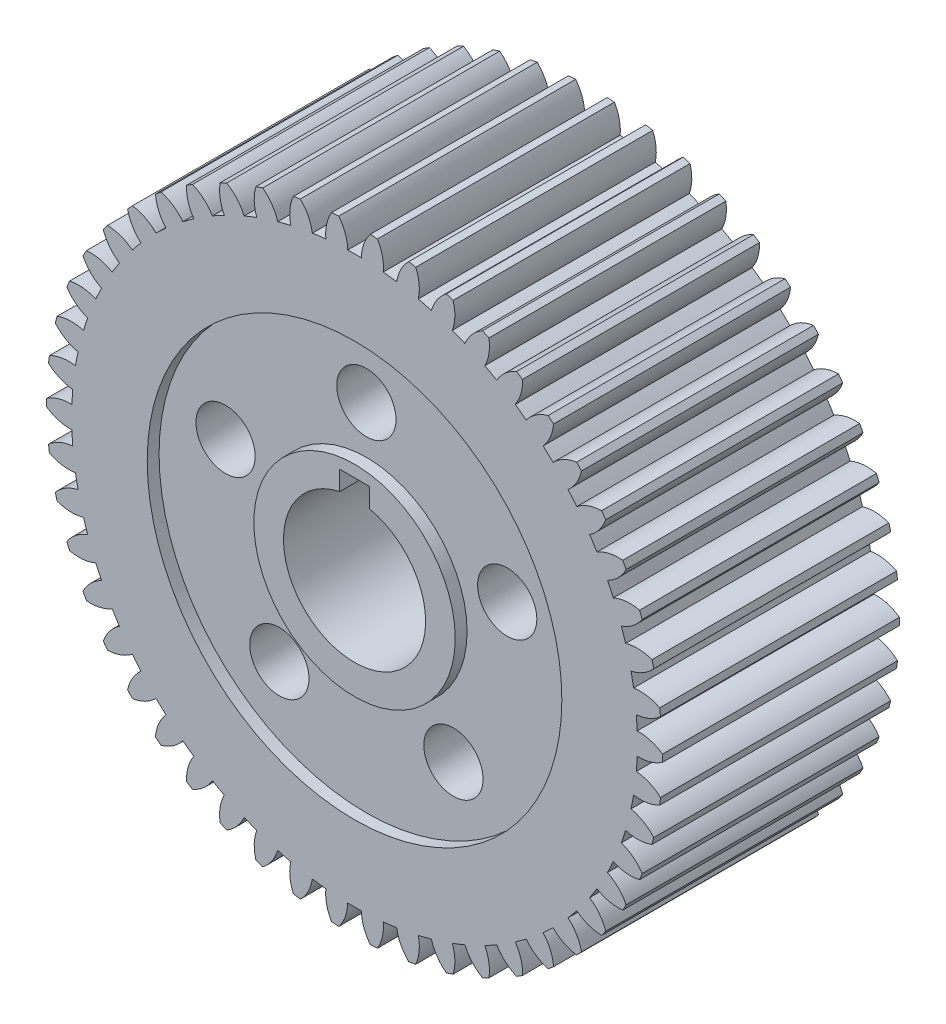
from build123d import *

# Parameters (mm, degrees)
SKETCH1_R           = 52
BOSS_EXTRUDE1_DEPTH = 20
CUT_EXTRUDE1_DEPTH  = 40
CIRPATTERN1_COUNT   = 50
CUT_EXTRUDE2_DEPTH  = 84.671466856
SKETCH5_4_R         = 35
SKETCH5_4_R_2       = 17
CUT_EXTRUDE3_DEPTH  = 2
CUT_EXTRUDE4_START  = -2
SKETCH6_R           = 35
SKETCH6_R_2         = 17
CUT_EXTRUDE4_DEPTH  = 2
SKETCH7_R           = 5
CUT_EXTRUDE5_DEPTH  = 83.733997642


with BuildPart() as part:
    # Sketch1 → Boss-Extrude1 (new, symmetric)
    with BuildSketch(Plane.XY):
        Circle(SKETCH1_R)
    extrude(amount=BOSS_EXTRUDE1_DEPTH, both=True)

    # Sketch4 → Cut-Extrude1 (cut)
    with BuildSketch(Plane.XY.offset(20)):
        with BuildLine():
            ThreePointArc((2.661885464, 51.93182421), (0, 52), (-2.661885464, 51.93182421))
            ThreePointArc((-2.661885464, 51.93182421), (-1.563915308, 49.957054015), (-1.147905342, 47.73620024))
            ThreePointArc((-1.147905342, 47.73620024), (0, 47.75), (1.147905342, 47.73620024))
            ThreePointArc((1.147905342, 47.73620024), (1.563915308, 49.957054015), (2.661885464, 51.93182421))
        make_face()
    cut_extrude1 = extrude(amount=-CUT_EXTRUDE1_DEPTH, mode=Mode.SUBTRACT)

    # CirPattern1: Cut-Extrude1 ×50 about axis
    cirpattern1_axis = Axis((0, 0, 20), (0, 0, -1))
    for i in range(1, CIRPATTERN1_COUNT):
        add(cut_extrude1.rotate(cirpattern1_axis, i * 360 / CIRPATTERN1_COUNT), mode=Mode.SUBTRACT)

    # Sketch5 → Cut-Extrude2 (cut, through all)
    with BuildSketch(Plane(origin=(0, 0, -20), x_dir=(-1, 0, 0), z_dir=(0, 0, -1))):
        with BuildLine():
            Line((-2.5, 15), (-2.5, 11.736694594))
            ThreePointArc((-2.5, 11.736694594), (0, -12), (2.5, 11.736694594))
            Line((2.5, 11.736694594), (2.5, 15))
            Line((2.5, 15), (-2.5, 15))
        make_face()
    extrude(amount=-CUT_EXTRUDE2_DEPTH, mode=Mode.SUBTRACT)

    # Sketch5<4> → Cut-Extrude3 (cut)
    with BuildSketch(Plane(origin=(0, 0, -20), x_dir=(-1, 0, 0), z_dir=(0, 0, -1))):
        Circle(SKETCH5_4_R)
        Circle(SKETCH5_4_R_2, mode=Mode.SUBTRACT)
    extrude(amount=-CUT_EXTRUDE3_DEPTH, mode=Mode.SUBTRACT)

    # Sketch6 → Cut-Extrude4 (cut)
    with BuildSketch(Plane.XY.offset(20).offset(CUT_EXTRUDE4_START)):
        Circle(SKETCH6_R)
        Circle(SKETCH6_R_2, mode=Mode.SUBTRACT)
    extrude(amount=CUT_EXTRUDE4_DEPTH, mode=Mode.SUBTRACT)

    # Sketch7 → Cut-Extrude5 (cut, through all)
    with BuildSketch(Plane.XY.offset(18)):
        with Locations((0, 25)):
            Circle(SKETCH7_R)
        with Locations((23.776412907, 7.725424859)):
            Circle(SKETCH7_R)
        with Locations((14.694631307, -20.225424859)):
            Circle(SKETCH7_R)
        with Locations((-14.694631307, -20.225424859)):
            Circle(SKETCH7_R)
        with Locations((-23.776412907, 7.725424859)):
            Circle(SKETCH7_R)
    extrude(amount=-CUT_EXTRUDE5_DEPTH, mode=Mode.SUBTRACT)


solid = part.part
